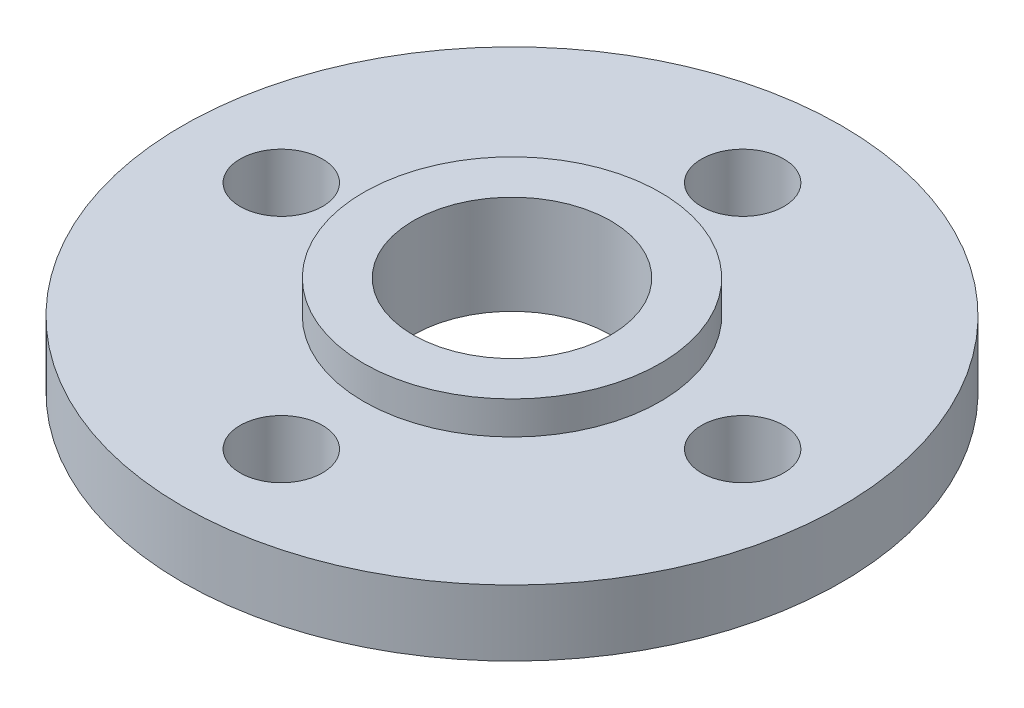
from build123d import *

# Parameters (mm, degrees)
SKETCH_1_R      = 10
SKETCH_1_R_2    = 1.25
SKETCH_1_R_3    = 3
EXTRUDE_1_DEPTH = 2
SKETCH_2_R      = 4.5
SKETCH_2_R_2    = 3
EXTRUDE_2_DEPTH = 1


with BuildPart() as part:
    # Эскиз1 → Бобышка-Вытянуть1 (new body)
    with BuildSketch(Plane(origin=(0, 0, 0), x_dir=(1, 0, 0), z_dir=(0, 1, 0))):
        with Locations(Location((0, 0, 0), (0, 0, 270))):
            Circle(SKETCH_1_R)
        with Locations(Location((7, 0, 0), (0, 0, 270))):
            Circle(SKETCH_1_R_2, mode=Mode.SUBTRACT)
        with Locations(Location((0, 0, 0), (0, 0, 270))):
            Circle(SKETCH_1_R_3, mode=Mode.SUBTRACT)
        with Locations(Location((0, -7, 0), (0, 0, 270))):
            Circle(SKETCH_1_R_2, mode=Mode.SUBTRACT)
        with Locations(Location((-7, 0, 0), (0, 0, 270))):
            Circle(SKETCH_1_R_2, mode=Mode.SUBTRACT)
        with Locations(Location((0, 7, 0), (0, 0, 270))):
            Circle(SKETCH_1_R_2, mode=Mode.SUBTRACT)
    extrude(amount=EXTRUDE_1_DEPTH)

    # Эскиз2 → Бобышка-Вытянуть2 (add)
    with BuildSketch(Plane(origin=(0, 2, 0), x_dir=(1, 0, 0), z_dir=(0, 1, 0))):
        with Locations(Location((0, 0, 0), (0, 0, 270))):
            Circle(SKETCH_2_R)
        with Locations(Location((0, 0, 0), (0, 0, 270))):
            Circle(SKETCH_2_R_2, mode=Mode.SUBTRACT)
    extrude(amount=EXTRUDE_2_DEPTH)


solid = part.part
